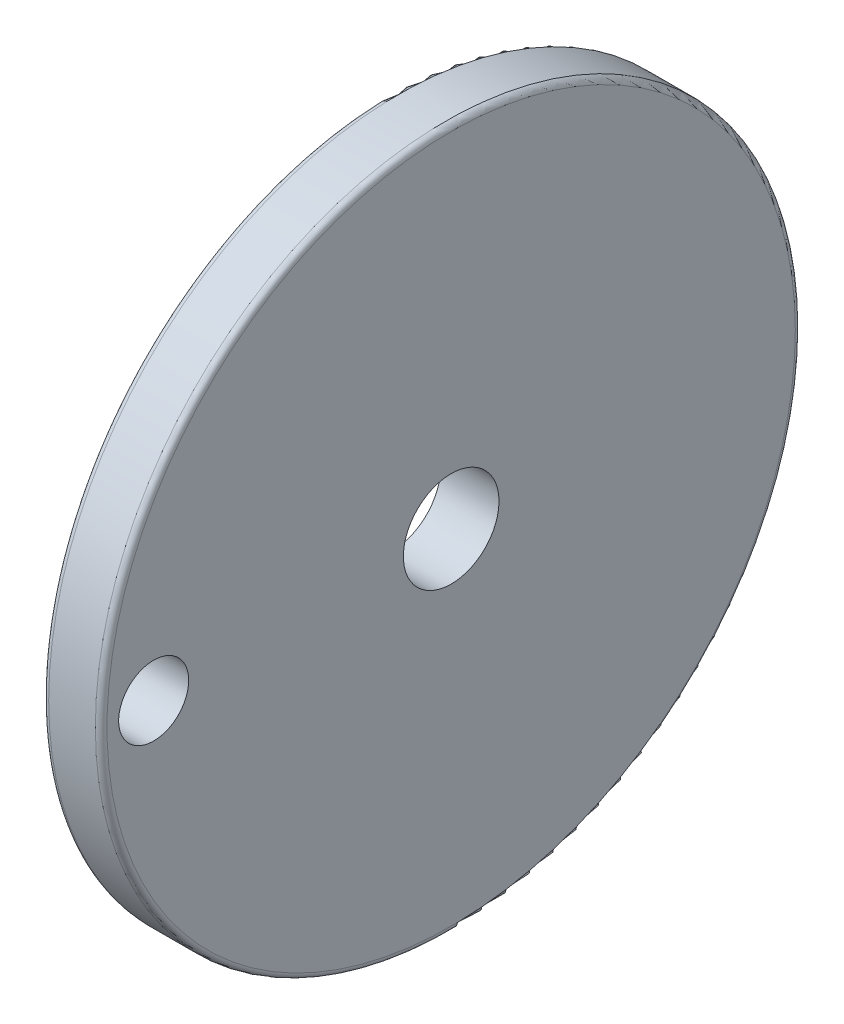
from build123d import *

# Parameters (mm, degrees)
SKETCH1_R           = 30
SKETCH1_R_2         = 3
SKETCH1_R_3         = 4.1
BOSS_EXTRUDE1_DEPTH = 5
FILLET1_R           = 0.5


with BuildPart() as part:
    # Sketch1 → Boss-Extrude1 (new body)
    with BuildSketch(Plane(origin=(0, 0, 0), x_dir=(0, 0, -1), z_dir=(1, 0, 0))):
        Circle(SKETCH1_R)
        with Locations((-25.5, 0)):
            Circle(SKETCH1_R_2, mode=Mode.SUBTRACT)
        Circle(SKETCH1_R_3, mode=Mode.SUBTRACT)
    extrude(amount=BOSS_EXTRUDE1_DEPTH)

    # Fillet1
    fillet1_edges = [part.edges().sort_by_distance(p)[0] for p in [
        (0, 0, 30),
        (5, 0, 30),
    ]]
    fillet(fillet1_edges, radius=FILLET1_R)


solid = part.part
